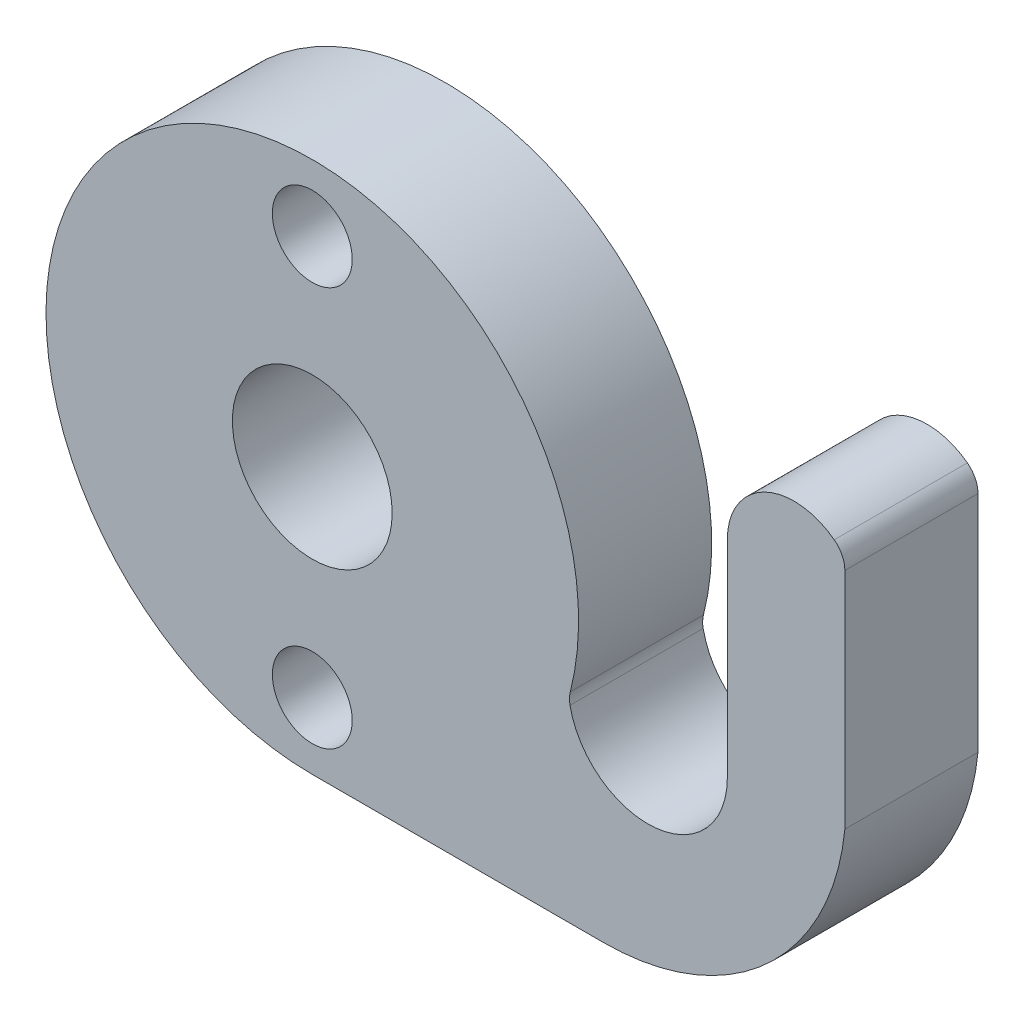
from build123d import *

# Parameters (mm, degrees)
ESQUISSE1_R        = 1.5
ESQUISSE1_R_2      = 3
BOSS_EXTRU_1_DEPTH = 5
CONG_3_R           = 1
CONG_7_R           = 1


with BuildPart() as part:
    # Esquisse1 → Boss.-Extru.1 (new body)
    with BuildSketch(Plane.XY):
        with BuildLine():
            Line((10.585988002, 5.428041782), (10.585988002, -2.326303621))
            ThreePointArc((10.585988002, -2.326303621), (7.77052424, -5.304066258), (4.639803855, -2.659733377))
            ThreePointArc((4.639803855, -2.659733377), (-11.05816252, 7.956045933), (-5, -10))
            Line((-5, -10), (5.93338076, -10))
            ThreePointArc((5.93338076, -10), (12.052569379, -7.638961176), (15, -1.779641556))
            Line((15, -1.779641556), (15, 0))
            Line((15, 0), (15, 7.057325334))
            ThreePointArc((15, 7.057325334), (12.225325109, 7.780597138), (10.585988002, 5.428041782))
        make_face()
        with Locations((-5, -7.5)):
            Circle(ESQUISSE1_R, mode=Mode.SUBTRACT)
        with Locations((-5, 0)):
            Circle(ESQUISSE1_R_2, mode=Mode.SUBTRACT)
        with Locations((-5, 7.5)):
            Circle(ESQUISSE1_R, mode=Mode.SUBTRACT)
    extrude(amount=BOSS_EXTRU_1_DEPTH)

    # Congé3
    cong_3_edges = [part.edges().sort_by_distance(p)[0] for p in [
        (15, 7.057325334, 2.5),
    ]]
    fillet(cong_3_edges, radius=CONG_3_R)

    # Congé7
    cong_7_edges = [part.edges().sort_by_distance(p)[0] for p in [
        (4.639803855, -2.659733377, 2.5),
    ]]
    fillet(cong_7_edges, radius=CONG_7_R)


solid = part.part
